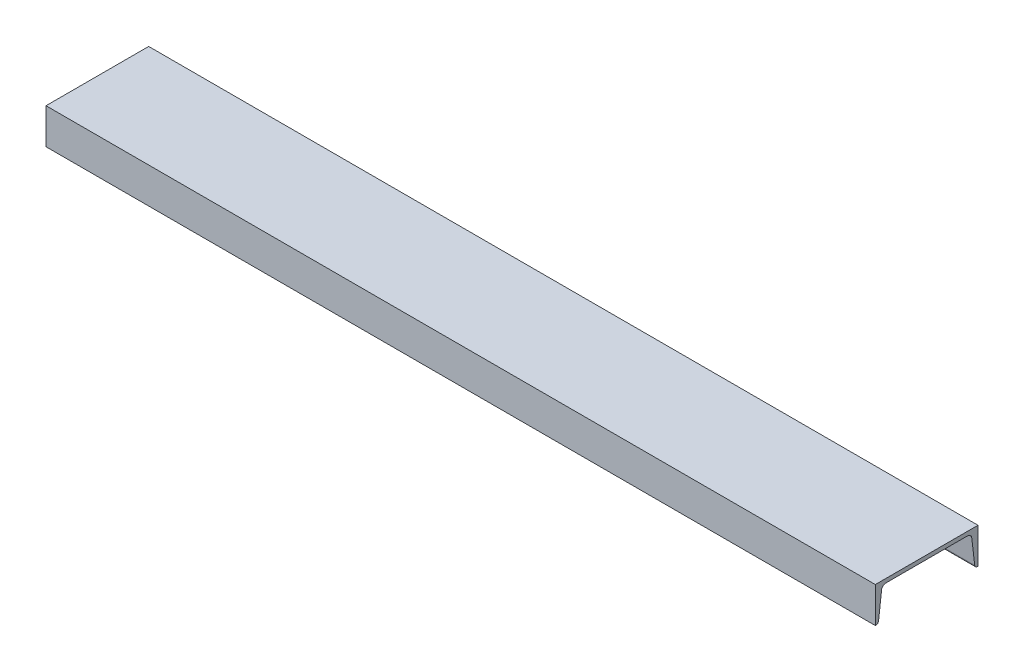
from build123d import *

# Parameters (mm, degrees)
EXTRUDE_2_DEPTH = 2100


with BuildPart() as part:
    # Эскиз2 → Бобышка-Вытянуть2 (new body)
    with BuildSketch(Plane(origin=(0, 0, 0), x_dir=(0, 0, -1), z_dir=(1, 0, 0))):
        with BuildLine():
            Line((130, 0), (-130, 0))
            Line((-130, 0), (-130, -90))
            Line((-130, -90), (-128.678333405, -90))
            ThreePointArc((-128.678333405, -90), (-124.028136062, -88.232175902), (-121.726718983, -83.821618477))
            Line((-121.726718983, -83.821618477), (-113.795983048, -16.720622289))
            ThreePointArc((-113.795983048, -16.720622289), (-108.696165424, -11.795261413), (-101.83727659, -10))
            Line((-101.83727659, -10), (101.83727659, -10))
            ThreePointArc((101.83727659, -10), (108.696165424, -11.795261413), (113.795983048, -16.720622289))
            Line((113.795983048, -16.720622289), (121.726718983, -83.821618477))
            ThreePointArc((121.726718983, -83.821618477), (124.028136062, -88.232175902), (128.678333405, -90))
            Line((128.678333405, -90), (130, -90))
            Line((130, -90), (130, 0))
        make_face()
    extrude(amount=EXTRUDE_2_DEPTH)


solid = part.part
